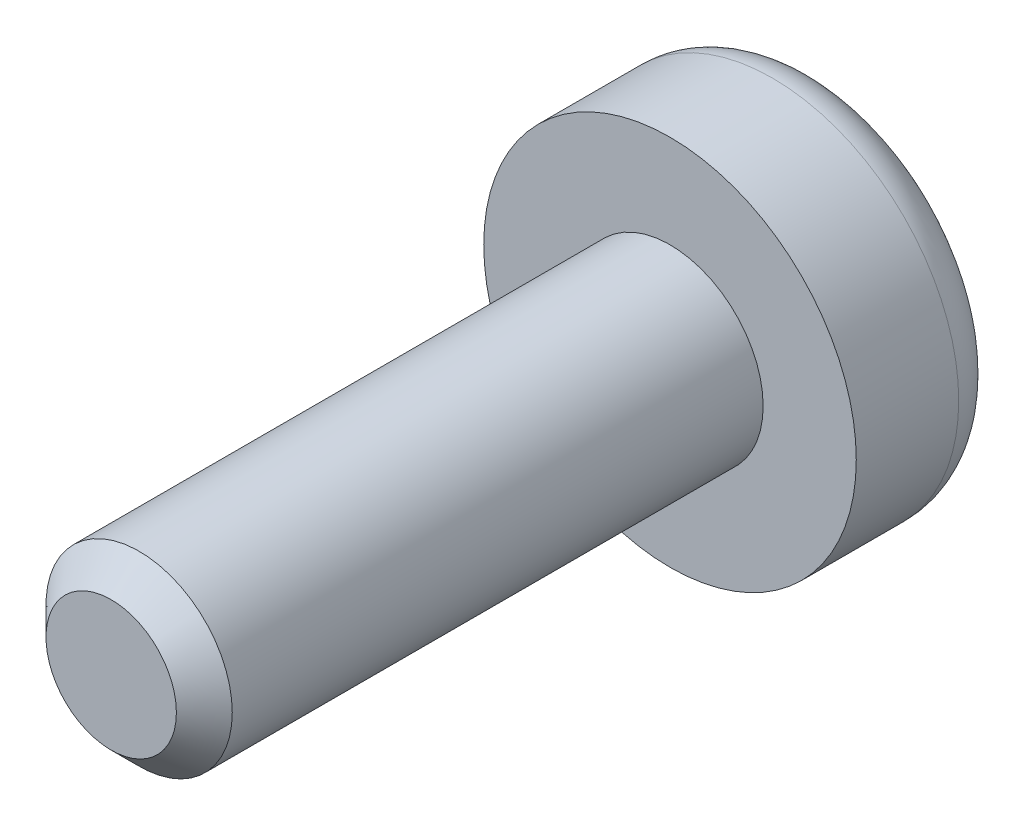
from build123d import *

# Parameters (mm, degrees)
SKETCH1_R          = 2
EXTRUDE1_DEPTH     = 1.6
SKETCH2_R          = 1
EXTRUDE2_DEPTH     = 6
CUT_EXTRUDE1_DEPTH = 0.5
FILLET1_R          = 0.2
CHAMFER1_SIZE      = 0.3
FILLET2_R          = 0.5


with BuildPart() as part:
    # Sketch1 → Extrude1 (new body)
    with BuildSketch(Plane.XY):
        Circle(SKETCH1_R)
    extrude(amount=EXTRUDE1_DEPTH)

    # Sketch2 → Extrude2 (add)
    with BuildSketch(Plane.XY.offset(1.6)):
        Circle(SKETCH2_R)
    extrude(amount=EXTRUDE2_DEPTH)

    # Sketch3 → Cut-Extrude1 (cut)
    with BuildSketch(Plane(origin=(0, 0, 0), x_dir=(-1, 0, 0), z_dir=(0, 0, -1))):
        Polygon((0.303448276, -0.280106101), (0.303448276, -1.258487543), (-0.331458886, -1.258487543), (-0.331458886, -0.280106101), (-1.343944387, -0.280106101), (-1.343944387, 0.382811671), (-0.331458886, 0.382811671), (-0.331458886, 1.389386448), (0.303448276, 1.389386448), (0.303448276, 0.382811671), (1.285259033, 0.382811671), (1.285259033, -0.280106101), align=None)
    extrude(amount=-CUT_EXTRUDE1_DEPTH, mode=Mode.SUBTRACT)

    # Fillet1
    fillet1_edges = [part.edges().sort_by_distance(p)[0] for p in [
        (0.331458886, 0.382811671, 0.25),
        (-0.303448276, 0.382811671, 0.25),
        (-0.303448276, -0.280106101, 0.25),
        (0.331458886, -0.280106101, 0.25),
    ]]
    fillet(fillet1_edges, radius=FILLET1_R)

    # Chamfer1
    chamfer1_edges = [part.edges().sort_by_distance(p)[0] for p in [
        (-1, 0, 7.6),
    ]]
    chamfer(chamfer1_edges, length=CHAMFER1_SIZE)

    # Fillet2
    fillet2_edges = [part.edges().sort_by_distance(p)[0] for p in [
        (-2, 0, 0),
    ]]
    fillet(fillet2_edges, radius=FILLET2_R)


solid = part.part
